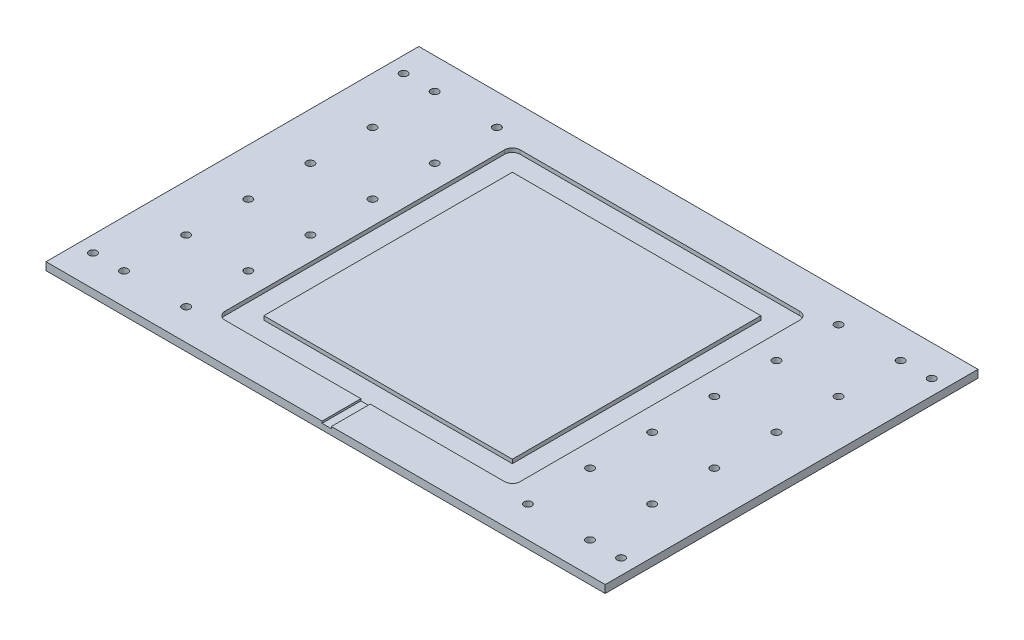
from build123d import *

# Parameters (mm, degrees)
SKETCH1_W             = 457.2
SKETCH1_H             = 304.8
BOSS_EXTRUDE2_DEPTH   = 6.35
SKETCH1_5_OUTSIDE_W   = 569.104
SKETCH1_5_OUTSIDE_H   = 416.704
SKETCH1_5_OUTSIDE_W_2 = 457.2
SKETCH1_5_OUTSIDE_H_2 = 304.8
SKETCH1_5_OUTSIDE_R   = 3.175
CUT_EXTRUDE3_DEPTH    = 6.35
SKETCH5_W             = 241.3
SKETCH5_H             = 241.3
SKETCH5_W_2           = 203.2
SKETCH5_H_2           = 203.2
CUT_EXTRUDE7_DEPTH    = 3.175
SKETCH6_W             = 7.62
SKETCH6_H             = 31.75
CUT_EXTRUDE8_DEPTH    = 1.5875
SKETCH12_R            = 3.175
CUT_EXTRUDE13_DEPTH   = 6.35
FILLET1_R             = 6.35


with BuildPart() as part:
    # Sketch1 → Boss-Extrude2 (new body)
    with BuildSketch(Plane(origin=(0, 0, 0), x_dir=(1, 0, 0), z_dir=(0, 1, 0))):
        with Locations((228.314285714, 152.4)):
            Rectangle(SKETCH1_W, SKETCH1_H)
    extrude(amount=BOSS_EXTRUDE2_DEPTH)

    # Sketch1<5> outside → Cut-Extrude3 (cut)
    # profile 1 of 25: a face of its own
    with BuildSketch(Plane(origin=(0, 0, 0), x_dir=(1, 0, 0), z_dir=(0, 1, 0))):
        with Locations((228.314, 152.4)):
            Rectangle(SKETCH1_5_OUTSIDE_W, SKETCH1_5_OUTSIDE_H)
        with Locations((228.314285714, 152.4)):
            Rectangle(SKETCH1_5_OUTSIDE_W_2, SKETCH1_5_OUTSIDE_H_2, mode=Mode.SUBTRACT)
    # profile 2 of 25: a face of its own
    with BuildSketch(Plane(origin=(0, 0, 0), x_dir=(1, 0, 0), z_dir=(0, 1, 0))):
        with Locations((38.1, 25.4)):
            Circle(SKETCH1_5_OUTSIDE_R)
    # profile 3 of 25: a face of its own
    with BuildSketch(Plane(origin=(0, 0, 0), x_dir=(1, 0, 0), z_dir=(0, 1, 0))):
        with Locations((38.1, 76.2)):
            Circle(SKETCH1_5_OUTSIDE_R)
    # profile 4 of 25: a face of its own
    with BuildSketch(Plane(origin=(0, 0, 0), x_dir=(1, 0, 0), z_dir=(0, 1, 0))):
        with Locations((38.1, 127)):
            Circle(SKETCH1_5_OUTSIDE_R)
    # profile 5 of 25: a face of its own
    with BuildSketch(Plane(origin=(0, 0, 0), x_dir=(1, 0, 0), z_dir=(0, 1, 0))):
        with Locations((38.1, 228.6)):
            Circle(SKETCH1_5_OUTSIDE_R)
    # profile 6 of 25: a face of its own
    with BuildSketch(Plane(origin=(0, 0, 0), x_dir=(1, 0, 0), z_dir=(0, 1, 0))):
        with Locations((38.1, 279.4)):
            Circle(SKETCH1_5_OUTSIDE_R)
    # profile 7 of 25: a face of its own
    with BuildSketch(Plane(origin=(0, 0, 0), x_dir=(1, 0, 0), z_dir=(0, 1, 0))):
        with Locations((38.1, 177.8)):
            Circle(SKETCH1_5_OUTSIDE_R)
    # profile 8 of 25: a face of its own
    with BuildSketch(Plane(origin=(0, 0, 0), x_dir=(1, 0, 0), z_dir=(0, 1, 0))):
        with Locations((88.9, 279.4)):
            Circle(SKETCH1_5_OUTSIDE_R)
    # profile 9 of 25: a face of its own
    with BuildSketch(Plane(origin=(0, 0, 0), x_dir=(1, 0, 0), z_dir=(0, 1, 0))):
        with Locations((88.9, 228.6)):
            Circle(SKETCH1_5_OUTSIDE_R)
    # profile 10 of 25: a face of its own
    with BuildSketch(Plane(origin=(0, 0, 0), x_dir=(1, 0, 0), z_dir=(0, 1, 0))):
        with Locations((88.9, 177.8)):
            Circle(SKETCH1_5_OUTSIDE_R)
    # profile 11 of 25: a face of its own
    with BuildSketch(Plane(origin=(0, 0, 0), x_dir=(1, 0, 0), z_dir=(0, 1, 0))):
        with Locations((88.9, 127)):
            Circle(SKETCH1_5_OUTSIDE_R)
    # profile 12 of 25: a face of its own
    with BuildSketch(Plane(origin=(0, 0, 0), x_dir=(1, 0, 0), z_dir=(0, 1, 0))):
        with Locations((88.9, 76.2)):
            Circle(SKETCH1_5_OUTSIDE_R)
    # profile 13 of 25: a face of its own
    with BuildSketch(Plane(origin=(0, 0, 0), x_dir=(1, 0, 0), z_dir=(0, 1, 0))):
        with Locations((88.9, 25.4)):
            Circle(SKETCH1_5_OUTSIDE_R)
    # profile 14 of 25: a face of its own
    with BuildSketch(Plane(origin=(0, 0, 0), x_dir=(1, 0, 0), z_dir=(0, 1, 0))):
        with Locations((368.3, 279.4)):
            Circle(SKETCH1_5_OUTSIDE_R)
    # profile 15 of 25: a face of its own
    with BuildSketch(Plane(origin=(0, 0, 0), x_dir=(1, 0, 0), z_dir=(0, 1, 0))):
        with Locations((419.1, 228.6)):
            Circle(SKETCH1_5_OUTSIDE_R)
    # profile 16 of 25: a face of its own
    with BuildSketch(Plane(origin=(0, 0, 0), x_dir=(1, 0, 0), z_dir=(0, 1, 0))):
        with Locations((419.1, 177.8)):
            Circle(SKETCH1_5_OUTSIDE_R)
    # profile 17 of 25: a face of its own
    with BuildSketch(Plane(origin=(0, 0, 0), x_dir=(1, 0, 0), z_dir=(0, 1, 0))):
        with Locations((368.3, 127)):
            Circle(SKETCH1_5_OUTSIDE_R)
    # profile 18 of 25: a face of its own
    with BuildSketch(Plane(origin=(0, 0, 0), x_dir=(1, 0, 0), z_dir=(0, 1, 0))):
        with Locations((368.3, 76.2)):
            Circle(SKETCH1_5_OUTSIDE_R)
    # profile 19 of 25: a face of its own
    with BuildSketch(Plane(origin=(0, 0, 0), x_dir=(1, 0, 0), z_dir=(0, 1, 0))):
        with Locations((368.3, 25.4)):
            Circle(SKETCH1_5_OUTSIDE_R)
    # profile 20 of 25: a face of its own
    with BuildSketch(Plane(origin=(0, 0, 0), x_dir=(1, 0, 0), z_dir=(0, 1, 0))):
        with Locations((419.1, 279.4)):
            Circle(SKETCH1_5_OUTSIDE_R)
    # profile 21 of 25: a face of its own
    with BuildSketch(Plane(origin=(0, 0, 0), x_dir=(1, 0, 0), z_dir=(0, 1, 0))):
        with Locations((419.1, 127)):
            Circle(SKETCH1_5_OUTSIDE_R)
    # profile 22 of 25: a face of its own
    with BuildSketch(Plane(origin=(0, 0, 0), x_dir=(1, 0, 0), z_dir=(0, 1, 0))):
        with Locations((419.1, 76.2)):
            Circle(SKETCH1_5_OUTSIDE_R)
    # profile 23 of 25: a face of its own
    with BuildSketch(Plane(origin=(0, 0, 0), x_dir=(1, 0, 0), z_dir=(0, 1, 0))):
        with Locations((419.1, 25.4)):
            Circle(SKETCH1_5_OUTSIDE_R)
    # profile 24 of 25: a face of its own
    with BuildSketch(Plane(origin=(0, 0, 0), x_dir=(1, 0, 0), z_dir=(0, 1, 0))):
        with Locations((368.3, 177.8)):
            Circle(SKETCH1_5_OUTSIDE_R)
    # profile 25 of 25: a face of its own
    with BuildSketch(Plane(origin=(0, 0, 0), x_dir=(1, 0, 0), z_dir=(0, 1, 0))):
        with Locations((368.3, 228.6)):
            Circle(SKETCH1_5_OUTSIDE_R)
    extrude(amount=CUT_EXTRUDE3_DEPTH, mode=Mode.SUBTRACT)

    # Sketch5 → Cut-Extrude7 (cut)
    with BuildSketch(Plane(origin=(0, 6.35, 0), x_dir=(1, 0, 0), z_dir=(0, 1, 0))):
        with Locations((228.6, 152.4)):
            Rectangle(SKETCH5_W, SKETCH5_H)
        with Locations((228.6, 152.4)):
            Rectangle(SKETCH5_W_2, SKETCH5_H_2, mode=Mode.SUBTRACT)
    extrude(amount=-CUT_EXTRUDE7_DEPTH, mode=Mode.SUBTRACT)

    # Sketch6 → Cut-Extrude8 (cut)
    with BuildSketch(Plane(origin=(0, 6.35, 0), x_dir=(1, 0, 0), z_dir=(0, 1, 0))):
        with Locations((229.235, 15.875)):
            Rectangle(SKETCH6_W, SKETCH6_H)
    extrude(amount=-CUT_EXTRUDE8_DEPTH, mode=Mode.SUBTRACT)

    # Sketch12 → Cut-Extrude13 (cut)
    with BuildSketch(Plane.XZ):
        with Locations((12.7, -25.4)):
            Circle(SKETCH12_R)
        with Locations((12.7, -279.4)):
            Circle(SKETCH12_R)
        with Locations((444.5, -25.4)):
            Circle(SKETCH12_R)
        with Locations((444.5, -279.4)):
            Circle(SKETCH12_R)
    extrude(amount=-CUT_EXTRUDE13_DEPTH, mode=Mode.SUBTRACT)

    # Fillet1
    fillet1_edges = [part.edges().sort_by_distance(p)[0] for p in [
        (349.25, 4.7625, -31.75),
        (107.95, 4.7625, -31.75),
        (349.25, 4.7625, -273.05),
        (107.95, 4.7625, -273.05),
    ]]
    fillet(fillet1_edges, radius=FILLET1_R)


solid = part.part
